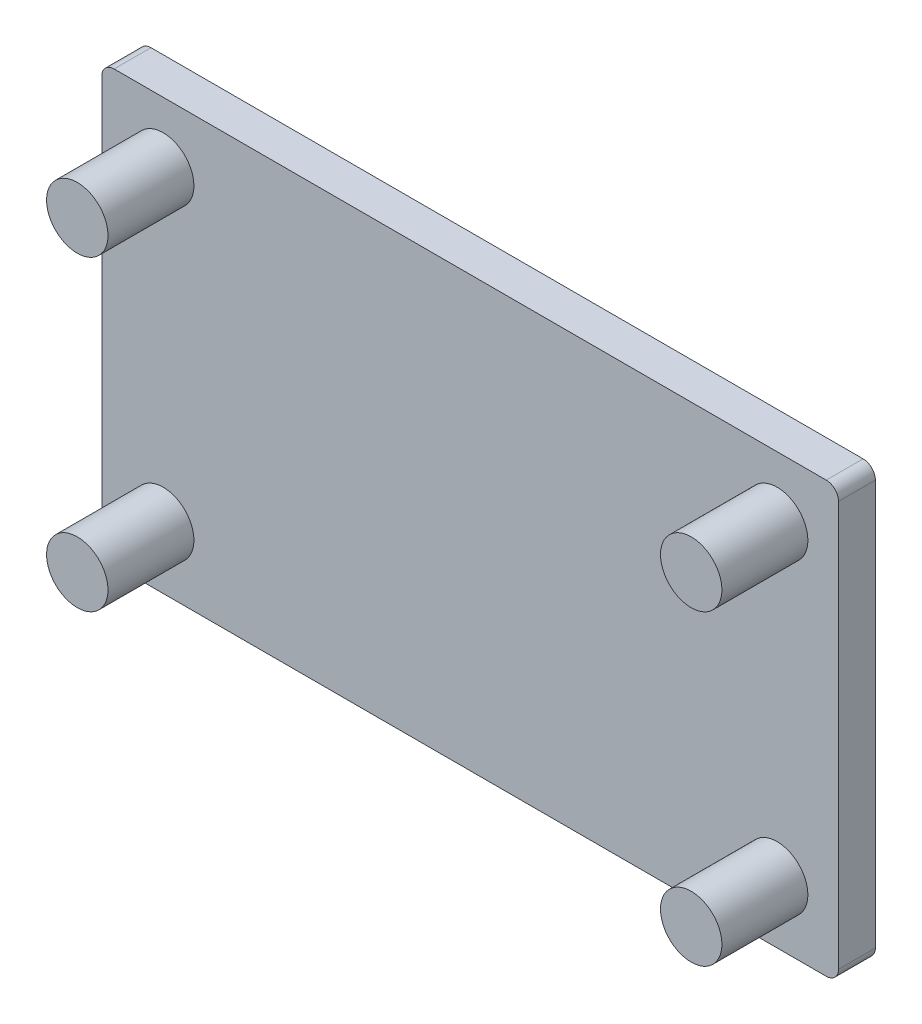
from build123d import *

# Parameters (mm, degrees)
SKETCH_1_W          = 60
SKETCH_1_H          = 35
EXTRUDE_1_DEPTH     = 3
FILLET_1_R          = 1
SKETCH_2_W          = 58
SKETCH_2_H          = 33
CUT_EXTRUDE_1_DEPTH = 1
FILLET_2_R          = 0.5
SKETCH_3_R          = 1
SKETCH_3_R_2        = 1.8
EXTRUDE_2_DEPTH     = 1
FILLET_5_R          = 0.9
SKETCH_4_R          = 2.5
EXTRUDE_3_DEPTH     = 7


with BuildPart() as part:
    # 草圖1 → 填料-伸長1 (new body)
    with BuildSketch(Plane.XY):
        with Locations((0, -2.493999949)):
            Rectangle(SKETCH_1_W, SKETCH_1_H)
    extrude(amount=EXTRUDE_1_DEPTH)

    # 圓角1
    fillet_1_edges = [part.edges().sort_by_distance(p)[0] for p in [
        (-30, 15.006000051, 1.5),
        (30, 15.006000051, 1.5),
        (30, -19.993999949, 1.5),
        (-30, -19.993999949, 1.5),
    ]]
    fillet(fillet_1_edges, radius=FILLET_1_R)

    # 草圖2 → 除料-伸長1 (cut)
    with BuildSketch(Plane.XY):
        with Locations((0, -2.493999949)):
            Rectangle(SKETCH_2_W, SKETCH_2_H)
    extrude(amount=CUT_EXTRUDE_1_DEPTH, mode=Mode.SUBTRACT)

    # 圓角2
    fillet_2_edges = [part.edges().sort_by_distance(p)[0] for p in [
        (29, -18.993999949, 0.5),
        (29, 14.006000051, 0.5),
        (-29, 14.006000051, 0.5),
        (-29, -18.993999949, 0.5),
    ]]
    fillet(fillet_2_edges, radius=FILLET_2_R)

    # 草圖3 → 填料-伸長2 (add)
    # profile 1 of 18: a face of its own
    with BuildSketch(Plane(origin=(0, 0, 1), x_dir=(-1, 0, 0), z_dir=(0, 0, -1))):
        with Locations((16.605864627, -11.590408673)):
            Circle(SKETCH_3_R)
    # profile 2 of 18: a face of its own
    with BuildSketch(Plane(origin=(0, 0, 1), x_dir=(-1, 0, 0), z_dir=(0, 0, -1))):
        with Locations((19.716080198, -10.097753374)):
            Circle(SKETCH_3_R_2)
    # profile 3 of 18: a face of its own
    with BuildSketch(Plane(origin=(0, 0, 1), x_dir=(-1, 0, 0), z_dir=(0, 0, -1))):
        Polygon((-25.746316962, -10.487625831), (-24.457925625, -14.339759351), (-20.787212343, -17.520537835), (-23.390948179, -14.339759351), align=None)
    # profile 4 of 18: a face of its own
    with BuildSketch(Plane(origin=(0, 0, 1), x_dir=(-1, 0, 0), z_dir=(0, 0, -1))):
        Polygon((-22.289971319, -9.225308291), (-20.125052457, -12.630867275), (-17.960499983, -16.334510998), (-20.125052457, -11.092385683), align=None)
    # profile 5 of 18: a face of its own
    with BuildSketch(Plane(origin=(0, 0, 1), x_dir=(-1, 0, 0), z_dir=(0, 0, -1))):
        Polygon((-25.37730312, -8.085964983), (-23.841775872, -11.58365246), (-18.713404958, -17.550593014), (-22.797768184, -10.169993512), (-22.900189922, -10.477389366), align=None)
    # profile 6 of 18: a face of its own
    with BuildSketch(Plane(origin=(0, 0, 1), x_dir=(-1, 0, 0), z_dir=(0, 0, -1))):
        with BuildLine():
            ThreePointArc((17.036310089, -16.144137721), (20.180543809, -12.568524264), (24.912645346, -13.096191133))
            ThreePointArc((24.912645346, -13.096191133), (20.547061469, -13.51565896), (17.036310089, -16.144137721))
        make_face()
    # profile 7 of 18: a face of its own
    with BuildSketch(Plane(origin=(0, 0, 1), x_dir=(-1, 0, 0), z_dir=(0, 0, -1))):
        with BuildLine():
            Line((-25.869565217, -5.597151862), (-25.869565217, 4.902848138))
            Line((-25.869565217, 4.902848138), (-22.46705163, 4.902848138))
            add(Edge.make_bspline(
                [(-22.46705163, 4.902848138), (-22.321957456, 4.901145897), (-22.040191767, 4.89784023), (-21.632274313, 4.86894773), (-21.251526575, 4.823132463), (-20.900208266, 4.75303157), (-20.574579701, 4.67016426), (-20.279109305, 4.561034768), (-20.008236351, 4.440416348), (-19.768715618, 4.292789558), (-19.555347837, 4.129931994), (-19.371740178, 3.943866358), (-19.217809716, 3.738145243), (-19.085465835, 3.515064403), (-18.989959614, 3.268630652), (-18.920977899, 3.003708763), (-18.877063093, 2.719969635), (-18.872109794, 2.52371007), (-18.869565217, 2.422888899)],
                knots=[0, 0, 0, 0, 1.402020869, 2.722654989, 3.950110139, 5.105271457, 6.182839017, 7.193223738, 8.145991228, 9.043198014, 9.905766409, 10.734443583, 11.560141935, 12.38384842, 13.232981204, 14.104313047, 15.026160196, 16, 16, 16, 16], degree=3))
            add(Edge.make_bspline(
                [(-18.869565217, 2.422888899), (-18.874374153, 2.295002495), (-18.883942705, 2.040541276), (-18.953204733, 1.667214701), (-19.071290378, 1.313146936), (-19.241334104, 0.987195047), (-19.460030163, 0.693072429), (-19.682634094, 0.480176921), (-19.884295006, 0.332506586), (-20.048932871, 0.231443768), (-20.228024768, 0.146193591), (-20.35366912, 0.09969125), (-20.417459239, 0.076081834)],
                knots=[0, 0, 0, 0, 1.273298406, 2.533538006, 3.766639183, 4.977638108, 6.179029059, 7.401702507, 8.028476186, 8.666091093, 9.322769338, 10, 10, 10, 10], degree=3))
            add(Edge.make_bspline(
                [(-20.417459239, 0.076081834), (-20.28521325, 0.049195474), (-20.018982423, -0.004930764), (-19.707828153, -0.146120928), (-19.469510556, -0.278589546), (-19.306042136, -0.400496003), (-19.149091975, -0.530224156), (-19.007899797, -0.678771574), (-18.875673165, -0.837969104), (-18.759252597, -1.011573608), (-18.658731473, -1.200092016), (-18.57115567, -1.400902414), (-18.499012357, -1.614471406), (-18.449548027, -1.841716761), (-18.417696688, -2.080387367), (-18.414610671, -2.244465536), (-18.413043478, -2.327790449)],
                knots=[0, 0, 0, 0, 1.6519262, 3.32557291, 4.166740498, 4.995835318, 5.824301884, 6.663779587, 7.507195088, 8.362647254, 9.224604015, 10.126598034, 11.049652309, 11.986803716, 12.977625078, 14, 14, 14, 14], degree=3))
            add(Edge.make_bspline(
                [(-18.413043478, -2.327790449), (-18.415764502, -2.459565142), (-18.421065642, -2.716290633), (-18.475833294, -3.08786687), (-18.556785341, -3.435515195), (-18.675920023, -3.757157242), (-18.832880496, -4.051030373), (-19.018139879, -4.323396873), (-19.242618085, -4.56678782), (-19.498250913, -4.786901701), (-19.786852405, -4.979470535), (-20.107388176, -5.142817241), (-20.45390951, -5.286926428), (-20.833044998, -5.398922171), (-21.240197802, -5.490967068), (-21.679582, -5.548741325), (-22.147562857, -5.592455681), (-22.470106776, -5.595557675), (-22.635869565, -5.597151862)],
                knots=[0, 0, 0, 0, 1.039371005, 2.024918617, 2.958047709, 3.852767572, 4.723053758, 5.582001921, 6.445494094, 7.328259018, 8.239147345, 9.176460892, 10.16391264, 11.196919877, 12.292741297, 13.455226912, 14.692182175, 16, 16, 16, 16], degree=3))
            Line((-22.635869565, -5.597151862), (-25.869565217, -5.597151862))
        make_face()
        with BuildLine():
            add(Edge.make_bspline(
                [(-21, 2.099519334), (-21.004288572, 2.192693357), (-21.012600458, 2.373278411), (-21.073429991, 2.589936017), (-21.147238708, 2.744293277), (-21.214761071, 2.851369508), (-21.297597103, 2.94875709), (-21.397599051, 3.034645381), (-21.509355672, 3.113675902), (-21.636460015, 3.182394472), (-21.778107143, 3.242313623), (-21.935173558, 3.291178559), (-22.107343826, 3.332525472), (-22.296805955, 3.359399793), (-22.503059922, 3.380039899), (-22.646905904, 3.380744028), (-22.721467391, 3.381109008)],
                knots=[0, 0, 0, 0, 1.599357931, 3.099792517, 3.824733362, 4.535069213, 5.269290696, 6.012427379, 6.794603599, 7.61746315, 8.490210935, 9.433542011, 10.441150938, 11.529478764, 12.719423833, 14, 14, 14, 14], degree=3))
            Line((-22.721467391, 3.381109008), (-23.891304348, 3.381109008))
            Line((-23.891304348, 3.381109008), (-23.891304348, 0.641978573))
            Line((-23.891304348, 0.641978573), (-22.721467391, 0.641978573))
            add(Edge.make_bspline(
                [(-22.721467391, 0.641978573), (-22.64532739, 0.643230793), (-22.499062551, 0.645636307), (-22.289119817, 0.667059758), (-22.098057426, 0.702106098), (-21.924749719, 0.751459116), (-21.769362002, 0.817857686), (-21.626986521, 0.88913314), (-21.50061449, 0.97463945), (-21.353869139, 1.099552087), (-21.19967464, 1.279818896), (-21.081954357, 1.534948251), (-21.010346078, 1.81021473), (-21.003502636, 2.001576071), (-21, 2.099519334)],
                knots=[0, 0, 0, 0, 1.069032976, 2.053610886, 2.959553848, 3.794328356, 4.577732592, 5.329421169, 6.02708937, 6.714020821, 8.033657071, 9.318040837, 10.627309837, 12, 12, 12, 12], degree=3))
        make_face(mode=Mode.SUBTRACT)
        with BuildLine():
            add(Edge.make_bspline(
                [(-22.490828804, -3.923238818), (-22.413087596, -3.922167549), (-22.261969355, -3.920085148), (-22.043409356, -3.895527139), (-21.839818915, -3.857860964), (-21.650963605, -3.805994576), (-21.476514136, -3.738359314), (-21.31596634, -3.661537871), (-21.16990495, -3.571803991), (-21.039775754, -3.470544708), (-20.925176954, -3.356580022), (-20.82132012, -3.237213801), (-20.738646183, -3.103152474), (-20.643033507, -2.917429298), (-20.559979775, -2.662432288), (-20.549025498, -2.449755897), (-20.543478261, -2.342056753)],
                knots=[0, 0, 0, 0, 1.157126176, 2.249294499, 3.270071966, 4.237898203, 5.160636285, 6.052674293, 6.8846023, 7.708539307, 8.501376315, 9.288660001, 10.058048539, 10.83920472, 12.39937595, 14, 14, 14, 14], degree=3))
            add(Edge.make_bspline(
                [(-20.543478261, -2.342056753), (-20.544402738, -2.28646276), (-20.546223095, -2.176994444), (-20.573672248, -2.018457671), (-20.614806369, -1.869018429), (-20.667526864, -1.727455742), (-20.744078064, -1.597897913), (-20.833353184, -1.476708817), (-20.940648969, -1.366111659), (-21.061379949, -1.263279261), (-21.200675552, -1.172898817), (-21.35624922, -1.094434699), (-21.529048118, -1.027611569), (-21.719423846, -0.973713713), (-21.926892177, -0.931400265), (-22.150772763, -0.900089208), (-22.392340899, -0.884845634), (-22.558973896, -0.881496981), (-22.645380435, -0.879760557)],
                knots=[0, 0, 0, 0, 0.919965197, 1.811473402, 2.655599999, 3.487070925, 4.30463685, 5.139728507, 5.975542427, 6.851443155, 7.761895275, 8.719057734, 9.733411133, 10.826385967, 11.992916024, 13.238912289, 14.568254558, 16, 16, 16, 16], degree=3))
            Line((-22.645380435, -0.879760557), (-23.891304348, -0.879760557))
            Line((-23.891304348, -0.879760557), (-23.891304348, -3.923238818))
            Line((-23.891304348, -3.923238818), (-22.490828804, -3.923238818))
        make_face(mode=Mode.SUBTRACT)
    # profile 8 of 18: a face of its own
    with BuildSketch(Plane(origin=(0, 0, 1), x_dir=(-1, 0, 0), z_dir=(0, 0, -1))):
        Polygon((-11.237092391, -5.597151862), (-11.819633152, -3.466717079), (-15.474184783, -3.466717079), (-16.075747283, -5.597151862), (-18.032608696, -5.597151862), (-14.917798913, 4.902848138), (-12.157269022, 4.902848138), (-9.054347826, -5.597151862), align=None)
        Polygon((-13.619565217, 3.102916073), (-14.998641304, -1.792804036), (-12.276154891, -1.792804036), align=None, mode=Mode.SUBTRACT)
    # profile 9 of 18: a face of its own
    with BuildSketch(Plane(origin=(0, 0, 1), x_dir=(-1, 0, 0), z_dir=(0, 0, -1))):
        with BuildLine():
            add(Edge.make_bspline(
                [(-0.304347826, -0.213999688), (-0.307732262, -0.413094914), (-0.314353892, -0.802623602), (-0.374022001, -1.372842717), (-0.463491751, -1.915811112), (-0.597733204, -2.428640659), (-0.76691184, -2.909894281), (-0.97887734, -3.357071003), (-1.237965376, -3.764935293), (-1.535325881, -4.138953406), (-1.878544998, -4.472561664), (-2.267807111, -4.763905609), (-2.700871942, -5.016811555), (-3.178937993, -5.228955736), (-3.704177913, -5.395999311), (-4.278009705, -5.51275787), (-4.901016982, -5.584811856), (-5.333013679, -5.592941751), (-5.556725543, -5.597151862)],
                knots=[0, 0, 0, 0, 1.110427075, 2.172544315, 3.195349749, 4.177748535, 5.125988168, 6.037741059, 6.932042727, 7.815964876, 8.69777207, 9.594508137, 10.521994162, 11.48995721, 12.506588634, 13.59059811, 14.752277985, 16, 16, 16, 16], degree=3))
            Line((-5.556725543, -5.597151862), (-8.217391304, -5.597151862))
            Line((-8.217391304, -5.597151862), (-8.217391304, 4.902848138))
            Line((-8.217391304, 4.902848138), (-5.114470109, 4.902848138))
            add(Edge.make_bspline(
                [(-5.114470109, 4.902848138), (-4.920121843, 4.899541907), (-4.543219828, 4.893130093), (-3.996619515, 4.833882888), (-3.486538146, 4.744830225), (-3.014505473, 4.610487057), (-2.579831728, 4.439686841), (-2.179711261, 4.230905914), (-1.821993359, 3.973897757), (-1.500262762, 3.678627067), (-1.213367231, 3.343771674), (-0.972297508, 2.961252064), (-0.763424195, 2.540295742), (-0.596462908, 2.075381192), (-0.46160879, 1.568276349), (-0.372887087, 1.014617513), (-0.313909696, 0.415787196), (-0.307611242, 0.000943286), (-0.304347826, -0.213999688)],
                knots=[0, 0, 0, 0, 1.153278946, 2.236568238, 3.259968389, 4.223524422, 5.144358991, 6.028301925, 6.89516473, 7.750925641, 8.615384892, 9.504135122, 10.427813762, 11.399741143, 12.431359603, 13.538177242, 14.724456375, 16, 16, 16, 16], degree=3))
        make_face()
        with BuildLine():
            add(Edge.make_bspline(
                [(-2.434782609, -0.342396427), (-2.436983589, -0.205256478), (-2.441274364, 0.062095628), (-2.463668106, 0.451909712), (-2.506764534, 0.818544431), (-2.565484353, 1.161785409), (-2.641740947, 1.482805918), (-2.746539079, 1.777170063), (-2.87318767, 2.046896325), (-3.022950562, 2.291592275), (-3.199668846, 2.509884676), (-3.404733256, 2.700167965), (-3.63681136, 2.862349599), (-3.897226964, 2.997109112), (-4.188315598, 3.101544383), (-4.510517276, 3.176672568), (-4.865884234, 3.222285847), (-5.113533225, 3.226653899), (-5.242866848, 3.228935095)],
                knots=[0, 0, 0, 0, 1.255554051, 2.44768226, 3.572651082, 4.633086061, 5.634384971, 6.589040905, 7.488061995, 8.357917203, 9.208928104, 10.050890238, 10.910395455, 11.793077134, 12.727247796, 13.733895114, 14.81653645, 16, 16, 16, 16], degree=3))
            Line((-5.242866848, 3.228935095), (-6.239130435, 3.228935095))
            Line((-6.239130435, 3.228935095), (-6.239130435, -3.923238818))
            Line((-6.239130435, -3.923238818), (-5.378396739, -3.923238818))
            add(Edge.make_bspline(
                [(-5.378396739, -3.923238818), (-5.261758733, -3.920507273), (-5.034887907, -3.915194187), (-4.70551876, -3.873862669), (-4.39670831, -3.808845607), (-4.110026987, -3.712885726), (-3.844541306, -3.592219016), (-3.601180558, -3.442645653), (-3.379416313, -3.266770884), (-3.18031351, -3.061852748), (-3.001599936, -2.829303931), (-2.851537174, -2.562938799), (-2.718669429, -2.26941382), (-2.616190534, -1.942332049), (-2.532264002, -1.586558247), (-2.477726002, -1.19812302), (-2.440839619, -0.780611779), (-2.436843354, -0.491488216), (-2.434782609, -0.342396427)],
                knots=[0, 0, 0, 0, 1.054031268, 2.050180318, 2.995897094, 3.902119281, 4.777280808, 5.626335315, 6.477804485, 7.328942045, 8.203017891, 9.120973329, 10.086270126, 11.110341295, 12.2138552, 13.387141734, 14.65263243, 16, 16, 16, 16], degree=3))
        make_face(mode=Mode.SUBTRACT)
    # profile 10 of 18: a face of its own
    with BuildSketch(Plane(origin=(0, 0, 1), x_dir=(-1, 0, 0), z_dir=(0, 0, -1))):
        with BuildLine():
            Line((1.065217391, -5.597151862), (1.065217391, 4.902848138))
            Line((1.065217391, 4.902848138), (4.467730978, 4.902848138))
            add(Edge.make_bspline(
                [(4.467730978, 4.902848138), (4.612825152, 4.901145897), (4.894590842, 4.89784023), (5.302508296, 4.86894773), (5.683256034, 4.823132463), (6.034574342, 4.75303157), (6.360202907, 4.67016426), (6.655673304, 4.561034768), (6.926546258, 4.440416348), (7.166066991, 4.292789558), (7.379434771, 4.129931994), (7.563042431, 3.943866358), (7.716972893, 3.738145243), (7.849316774, 3.515064403), (7.944822995, 3.268630652), (8.01380471, 3.003708763), (8.057719515, 2.719969635), (8.062672815, 2.52371007), (8.065217391, 2.422888899)],
                knots=[0, 0, 0, 0, 1.402020869, 2.722654989, 3.950110139, 5.105271457, 6.182839017, 7.193223738, 8.145991228, 9.043198014, 9.905766409, 10.734443583, 11.560141935, 12.38384842, 13.232981204, 14.104313047, 15.026160196, 16, 16, 16, 16], degree=3))
            add(Edge.make_bspline(
                [(8.065217391, 2.422888899), (8.060408455, 2.295002495), (8.050839903, 2.040541276), (7.981577875, 1.667214701), (7.863492231, 1.313146936), (7.693448505, 0.987195047), (7.474752446, 0.693072429), (7.252148514, 0.480176921), (7.050487603, 0.332506586), (6.885849738, 0.231443768), (6.706757841, 0.146193591), (6.581113488, 0.09969125), (6.51732337, 0.076081834)],
                knots=[0, 0, 0, 0, 1.273298406, 2.533538006, 3.766639183, 4.977638108, 6.179029059, 7.401702507, 8.028476186, 8.666091093, 9.322769338, 10, 10, 10, 10], degree=3))
            add(Edge.make_bspline(
                [(6.51732337, 0.076081834), (6.649569359, 0.049195474), (6.915800186, -0.004930764), (7.226954455, -0.146120928), (7.465272053, -0.278589546), (7.628740473, -0.400496003), (7.785690633, -0.530224156), (7.926882811, -0.678771574), (8.059109443, -0.837969104), (8.175530012, -1.011573608), (8.276051136, -1.200092016), (8.363626939, -1.400902414), (8.435770252, -1.614471406), (8.485234582, -1.841716761), (8.517085921, -2.080387367), (8.520171938, -2.244465536), (8.52173913, -2.327790449)],
                knots=[0, 0, 0, 0, 1.6519262, 3.32557291, 4.166740498, 4.995835318, 5.824301884, 6.663779587, 7.507195088, 8.362647254, 9.224604015, 10.126598034, 11.049652309, 11.986803716, 12.977625078, 14, 14, 14, 14], degree=3))
            add(Edge.make_bspline(
                [(8.52173913, -2.327790449), (8.519018107, -2.459565142), (8.513716967, -2.716290633), (8.458949314, -3.08786687), (8.377997267, -3.435515195), (8.258862586, -3.757157242), (8.101902113, -4.051030373), (7.91664273, -4.323396873), (7.692164524, -4.56678782), (7.436531696, -4.786901701), (7.147930204, -4.979470535), (6.827394432, -5.142817241), (6.480873099, -5.286926428), (6.10173761, -5.398922171), (5.694584807, -5.490967068), (5.255200609, -5.548741325), (4.787219752, -5.592455681), (4.464675833, -5.595557675), (4.298913043, -5.597151862)],
                knots=[0, 0, 0, 0, 1.039371005, 2.024918617, 2.958047709, 3.852767572, 4.723053758, 5.582001921, 6.445494094, 7.328259018, 8.239147345, 9.176460892, 10.16391264, 11.196919877, 12.292741297, 13.455226912, 14.692182175, 16, 16, 16, 16], degree=3))
            Line((4.298913043, -5.597151862), (1.065217391, -5.597151862))
        make_face()
        with BuildLine():
            add(Edge.make_bspline(
                [(5.934782609, 2.099519334), (5.930494037, 2.192693357), (5.922182151, 2.373278411), (5.861352618, 2.589936017), (5.787543901, 2.744293277), (5.720021538, 2.851369508), (5.637185506, 2.94875709), (5.537183557, 3.034645381), (5.425426936, 3.113675902), (5.298322593, 3.182394472), (5.156675466, 3.242313623), (4.99960905, 3.291178559), (4.827438783, 3.332525472), (4.637976654, 3.359399793), (4.431722687, 3.380039899), (4.287876704, 3.380744028), (4.213315217, 3.381109008)],
                knots=[0, 0, 0, 0, 1.599357931, 3.099792517, 3.824733362, 4.535069213, 5.269290696, 6.012427379, 6.794603599, 7.61746315, 8.490210935, 9.433542011, 10.441150938, 11.529478764, 12.719423833, 14, 14, 14, 14], degree=3))
            Line((4.213315217, 3.381109008), (3.043478261, 3.381109008))
            Line((3.043478261, 3.381109008), (3.043478261, 0.641978573))
            Line((3.043478261, 0.641978573), (4.213315217, 0.641978573))
            add(Edge.make_bspline(
                [(4.213315217, 0.641978573), (4.289455219, 0.643230793), (4.435720057, 0.645636307), (4.645662792, 0.667059758), (4.836725183, 0.702106098), (5.010032889, 0.751459116), (5.165420607, 0.817857686), (5.307796087, 0.88913314), (5.434168118, 0.97463945), (5.58091347, 1.099552087), (5.735107969, 1.279818896), (5.852828252, 1.534948251), (5.92443653, 1.81021473), (5.931279973, 2.001576071), (5.934782609, 2.099519334)],
                knots=[0, 0, 0, 0, 1.069032976, 2.053610886, 2.959553848, 3.794328356, 4.577732592, 5.329421169, 6.02708937, 6.714020821, 8.033657071, 9.318040837, 10.627309837, 12, 12, 12, 12], degree=3))
        make_face(mode=Mode.SUBTRACT)
        with BuildLine():
            add(Edge.make_bspline(
                [(4.443953804, -3.923238818), (4.521695013, -3.922167549), (4.672813254, -3.920085148), (4.891373252, -3.895527139), (5.094963693, -3.857860964), (5.283819004, -3.805994576), (5.458268473, -3.738359314), (5.618816268, -3.661537871), (5.764877659, -3.571803991), (5.895006854, -3.470544708), (6.009605655, -3.356580022), (6.113462489, -3.237213801), (6.196136426, -3.103152474), (6.291749102, -2.917429298), (6.374802834, -2.662432288), (6.385757111, -2.449755897), (6.391304348, -2.342056753)],
                knots=[0, 0, 0, 0, 1.157126176, 2.249294499, 3.270071966, 4.237898203, 5.160636285, 6.052674293, 6.8846023, 7.708539307, 8.501376315, 9.288660001, 10.058048539, 10.83920472, 12.39937595, 14, 14, 14, 14], degree=3))
            add(Edge.make_bspline(
                [(6.391304348, -2.342056753), (6.390379871, -2.28646276), (6.388559514, -2.176994444), (6.36111036, -2.018457671), (6.31997624, -1.869018429), (6.267255745, -1.727455742), (6.190704545, -1.597897913), (6.101429424, -1.476708817), (5.99413364, -1.366111659), (5.87340266, -1.263279261), (5.734107057, -1.172898817), (5.578533389, -1.094434699), (5.405734491, -1.027611569), (5.215358762, -0.973713713), (5.007890432, -0.931400265), (4.784009846, -0.900089208), (4.542441709, -0.884845634), (4.375808713, -0.881496981), (4.289402174, -0.879760557)],
                knots=[0, 0, 0, 0, 0.919965197, 1.811473402, 2.655599999, 3.487070925, 4.30463685, 5.139728507, 5.975542427, 6.851443155, 7.761895275, 8.719057734, 9.733411133, 10.826385967, 11.992916024, 13.238912289, 14.568254558, 16, 16, 16, 16], degree=3))
            Line((4.289402174, -0.879760557), (3.043478261, -0.879760557))
            Line((3.043478261, -0.879760557), (3.043478261, -3.923238818))
            Line((3.043478261, -3.923238818), (4.443953804, -3.923238818))
        make_face(mode=Mode.SUBTRACT)
    # profile 11 of 18: a face of its own
    with BuildSketch(Plane(origin=(0, 0, 1), x_dir=(-1, 0, 0), z_dir=(0, 0, -1))):
        with BuildLine():
            add(Edge.make_bspline(
                [(17.804347826, -0.299597514), (17.800255963, -0.528783524), (17.792353603, -0.971396247), (17.731495124, -1.611642454), (17.625305448, -2.202560978), (17.477954054, -2.744970782), (17.294843387, -3.238842359), (17.080405144, -3.687823483), (16.833717545, -4.091210586), (16.554146923, -4.44857572), (16.244489082, -4.758438845), (15.913792892, -5.030751022), (15.552941486, -5.255024913), (15.170075279, -5.438066319), (14.7678988, -5.578548982), (14.349778202, -5.674219555), (13.919658172, -5.740090844), (13.626948883, -5.74622909), (13.479279891, -5.749325775)],
                knots=[0, 0, 0, 0, 1.399094986, 2.701985343, 3.921606295, 5.060250114, 6.128937938, 7.133140352, 8.093336986, 9.010033534, 9.896223585, 10.76303321, 11.619598843, 12.483160966, 13.349322064, 14.214333538, 15.099148625, 16, 16, 16, 16], degree=3))
            add(Edge.make_bspline(
                [(13.479279891, -5.749325775), (13.31024205, -5.745499111), (12.981971932, -5.73806776), (12.505606136, -5.672500331), (12.061228859, -5.566832156), (11.648955094, -5.416893841), (11.269695932, -5.222624502), (10.922192596, -4.986258283), (10.608305332, -4.704723263), (10.326778675, -4.381946993), (10.078486529, -4.017672689), (9.864942877, -3.613577632), (9.683511153, -3.170785327), (9.538640233, -2.689264517), (9.420229117, -2.170871443), (9.343043071, -1.613156082), (9.291076623, -1.017068202), (9.285489625, -0.606444059), (9.282608696, -0.394706209)],
                knots=[0, 0, 0, 0, 1.046182631, 2.031678192, 2.97076483, 3.86965419, 4.740954983, 5.602542005, 6.464464361, 7.344346083, 8.248138063, 9.187737429, 10.169205071, 11.206116273, 12.297806163, 13.458167033, 14.68930686, 16, 16, 16, 16], degree=3))
            add(Edge.make_bspline(
                [(9.282608696, -0.394706209), (9.286639524, -0.165510766), (9.294424014, 0.277120176), (9.356014211, 0.916322492), (9.459125961, 1.506782845), (9.605932632, 2.048887457), (9.793305311, 2.542134977), (10.005709485, 2.993116422), (10.253353986, 3.396858835), (10.532786869, 3.754271154), (10.842450525, 4.064181714), (11.173250681, 4.336266854), (11.53339686, 4.561210936), (11.917496575, 4.740961843), (12.320023627, 4.88174374), (12.73773771, 4.980057103), (13.168095186, 5.045804024), (13.460011587, 5.051925514), (13.60767663, 5.055022051)],
                knots=[0, 0, 0, 0, 1.399147349, 2.702086469, 3.916134137, 5.054820572, 6.125245074, 7.133847534, 8.094080105, 9.010810961, 9.897034179, 10.763876246, 11.620473937, 12.481991629, 13.348185144, 14.219056267, 15.099114909, 16, 16, 16, 16], degree=3))
            add(Edge.make_bspline(
                [(13.60767663, 5.055022051), (13.776713626, 5.051194148), (14.104982101, 5.043760391), (14.581359487, 4.978209945), (15.025695843, 4.872481801), (15.4381133, 4.722754069), (15.816461741, 4.527935958), (16.165517666, 4.294647172), (16.478514656, 4.012618145), (16.760296854, 3.690113034), (17.007725954, 3.326135152), (17.222743949, 2.923616788), (17.402797559, 2.481804481), (17.549158714, 2.000749577), (17.666566094, 1.481256863), (17.743950819, 0.921235474), (17.795795262, 0.323546874), (17.801441791, -0.087862242), (17.804347826, -0.299597514)],
                knots=[0, 0, 0, 0, 1.04600235, 2.031328089, 2.970252902, 3.868987364, 4.740138012, 5.59881955, 6.460593378, 7.340323477, 8.243959714, 9.179069388, 10.160367901, 11.192410958, 12.288699193, 13.453715767, 14.689532722, 16, 16, 16, 16], degree=3))
        make_face()
        with BuildLine():
            add(Edge.make_bspline(
                [(15.673913043, -0.394706209), (15.67288444, -0.247247521), (15.670892133, 0.038366048), (15.645955555, 0.452362452), (15.609682245, 0.837419604), (15.555380474, 1.193204568), (15.484235851, 1.519523696), (15.398973148, 1.81753202), (15.300963803, 2.087662219), (15.182828721, 2.327699863), (15.051542526, 2.54225912), (14.894100731, 2.725709315), (14.71691828, 2.880129302), (14.523035026, 3.011995431), (14.305411598, 3.109537573), (14.068240597, 3.177138091), (13.81222058, 3.221593063), (13.634818032, 3.226439695), (13.543478261, 3.228935095)],
                knots=[0, 0, 0, 0, 1.486095503, 2.8784268, 4.178896477, 5.383313849, 6.50370181, 7.542880676, 8.505944191, 9.395566462, 10.23559869, 11.034510805, 11.821349203, 12.599050339, 13.389126436, 14.213243526, 15.080047443, 16, 16, 16, 16], degree=3))
            add(Edge.make_bspline(
                [(13.543478261, 3.228935095), (13.452161839, 3.226365939), (13.275586528, 3.221398052), (13.020300913, 3.178292919), (12.785757478, 3.104748666), (12.572191757, 3.001671637), (12.378456455, 2.871031907), (12.204401926, 2.712264525), (12.045914259, 2.527247386), (11.905971492, 2.314570329), (11.784323943, 2.075183894), (11.683777549, 1.808836926), (11.594604007, 1.518669042), (11.527706044, 1.201721251), (11.475085546, 0.861179971), (11.44173105, 0.495840825), (11.415933931, 0.106564259), (11.414025243, -0.161641467), (11.413043478, -0.299597514)],
                knots=[0, 0, 0, 0, 0.940493395, 1.818598556, 2.65806311, 3.465325826, 4.253609174, 5.057352584, 5.885618443, 6.757702066, 7.674492596, 8.646685703, 9.687886232, 10.799631583, 11.981266591, 13.236822997, 14.578714251, 16, 16, 16, 16], degree=3))
            add(Edge.make_bspline(
                [(11.413043478, -0.299597514), (11.414151536, -0.447048837), (11.41629774, -0.732648141), (11.440164098, -1.14682439), (11.480131908, -1.531619811), (11.534841938, -1.887942275), (11.602106062, -2.215639907), (11.686676057, -2.514287973), (11.790468732, -2.782285728), (11.904316351, -3.024545803), (12.042042164, -3.236395045), (12.19665182, -3.421344771), (12.372212628, -3.578596146), (12.569189833, -3.705132992), (12.785450133, -3.803672137), (13.02108733, -3.871439419), (13.275496053, -3.916043163), (13.452130999, -3.920786031), (13.543478261, -3.923238818)],
                knots=[0, 0, 0, 0, 1.486662466, 2.879524953, 4.181300558, 5.38617743, 6.513130284, 7.552705609, 8.511484829, 9.408629925, 10.246547046, 11.051854149, 11.833006184, 12.613299248, 13.403676768, 14.220441868, 15.079696471, 16, 16, 16, 16], degree=3))
            add(Edge.make_bspline(
                [(13.543478261, -3.923238818), (13.634774045, -3.920587901), (13.812091159, -3.915439219), (14.068420155, -3.873163002), (14.302831285, -3.798322003), (14.519004295, -3.698695935), (14.712165307, -3.564774733), (14.889786612, -3.408266639), (15.045507904, -3.221135408), (15.183834451, -3.008967794), (15.301258176, -2.768222544), (15.407328932, -2.505337144), (15.488413346, -2.213607181), (15.557856593, -1.897835238), (15.608320587, -1.556032148), (15.64623507, -1.190338867), (15.670743928, -0.800836521), (15.672836628, -0.53265157), (15.673913043, -0.394706209)],
                knots=[0, 0, 0, 0, 0.940029382, 1.82575022, 2.664800606, 3.468147471, 4.267377886, 5.076798435, 5.899366548, 6.766536204, 7.679194691, 8.653886611, 9.682108903, 10.79330575, 11.982426563, 13.238186273, 14.579415474, 16, 16, 16, 16], degree=3))
        make_face(mode=Mode.SUBTRACT)
    # profile 12 of 18: a face of its own
    with BuildSketch(Plane(origin=(0, 0, 1), x_dir=(-1, 0, 0), z_dir=(0, 0, -1))):
        Polygon((23.434782609, -1.878401862), (23.434782609, -5.597151862), (21.456521739, -5.597151862), (21.456521739, -1.892668166), (18.108695652, 4.902848138), (20.239130435, 4.902848138), (21.768002717, 1.657263899), (22.469429348, 0.066570964), (23.180366848, 1.704818247), (24.804347826, 4.902848138), (26.934782609, 4.902848138), align=None)
    # profile 13 of 18: a face of its own
    with BuildSketch(Plane(origin=(0, 0, 1), x_dir=(-1, 0, 0), z_dir=(0, 0, -1))):
        Polygon((-8.173913043, 12.368318892), (-8.173913043, 9.006000051), (-8.927536232, 9.006000051), (-8.927536232, 12.368318892), (-10.028985507, 12.368318892), (-10.028985507, 13.006000051), (-7.072463768, 13.006000051), (-7.072463768, 12.368318892), align=None)
    # profile 14 of 18: a face of its own
    with BuildSketch(Plane(origin=(0, 0, 1), x_dir=(-1, 0, 0), z_dir=(0, 0, -1))):
        Polygon((-4.280797101, 9.006000051), (-4.502717391, 9.817594254), (-5.894927536, 9.817594254), (-6.124094203, 9.006000051), (-6.869565217, 9.006000051), (-5.682971014, 13.006000051), (-4.63134058, 13.006000051), (-3.449275362, 9.006000051), align=None)
        Polygon((-5.188405797, 12.320311645), (-5.713768116, 10.455275413), (-4.676630435, 10.455275413), align=None, mode=Mode.SUBTRACT)
    # profile 15 of 18: a face of its own
    with BuildSketch(Plane(origin=(0, 0, 1), x_dir=(-1, 0, 0), z_dir=(0, 0, -1))):
        Polygon((-2.956521739, 12.368318892), (-2.956521739, 13.006000051), (-0.463768116, 13.006000051), (-0.463768116, 12.368318892), (-1.333333333, 12.368318892), (-1.333333333, 9.64368121), (-0.463768116, 9.64368121), (-0.463768116, 9.006000051), (-2.956521739, 9.006000051), (-2.956521739, 9.64368121), (-2.086956522, 9.64368121), (-2.086956522, 12.368318892), align=None)
    # profile 16 of 18: a face of its own
    with BuildSketch(Plane(origin=(0, 0, 1), x_dir=(-1, 0, 0), z_dir=(0, 0, -1))):
        Polygon((3.130434783, 9.006000051), (2.246376812, 9.006000051), (1.85326087, 10.280456573), (1.710144928, 10.799478312), (1.559782609, 10.267775413), (1.136775362, 9.006000051), (0.289855072, 9.006000051), (0.086956522, 13.006000051), (0.750905797, 13.006000051), (0.828804348, 10.441688457), (0.848731884, 9.7406015), (1.043478261, 10.34386237), (1.518115942, 11.788608747), (1.991847826, 11.788608747), (2.454710145, 10.236072515), (2.604166667, 9.74694208), (2.614130435, 10.371036283), (2.694746377, 13.006000051), (3.333333333, 13.006000051), align=None)
    # profile 17 of 18: a face of its own
    with BuildSketch(Plane(origin=(0, 0, 1), x_dir=(-1, 0, 0), z_dir=(0, 0, -1))):
        Polygon((5.980072464, 9.006000051), (5.758152174, 9.817594254), (4.365942029, 9.817594254), (4.136775362, 9.006000051), (3.391304348, 9.006000051), (4.577898551, 13.006000051), (5.629528986, 13.006000051), (6.811594203, 9.006000051), align=None)
        Polygon((5.072463768, 12.320311645), (4.547101449, 10.455275413), (5.58423913, 10.455275413), align=None, mode=Mode.SUBTRACT)
    # profile 18 of 18: a face of its own
    with BuildSketch(Plane(origin=(0, 0, 1), x_dir=(-1, 0, 0), z_dir=(0, 0, -1))):
        Polygon((9.101449275, 9.006000051), (8.043478261, 11.392775413), (7.826086957, 11.907268167), (7.826086957, 10.248753674), (7.826086957, 9.006000051), (7.130434783, 9.006000051), (7.130434783, 13.006000051), (8.065217391, 13.006000051), (9.143115942, 10.603826138), (9.333333333, 10.135529036), (9.333333333, 11.900927587), (9.333333333, 13.006000051), (10.028985507, 13.006000051), (10.028985507, 9.006000051), align=None)
    extrude(amount=EXTRUDE_2_DEPTH)

    # 圓角5
    fillet_5_edges = [part.edges().sort_by_distance(p)[0] for p in [
        (-15.605864627, -11.590408673, 0),
        (-17.916080198, -10.097753374, 0),
    ]]
    fillet(fillet_5_edges, radius=FILLET_5_R)

    # 草圖4 → 填料-伸長3 (add)
    with BuildSketch(Plane.XY.offset(3)):
        with Locations((-25, 10.006000051)):
            Circle(SKETCH_4_R)
        with Locations((-25, -14.993999949)):
            Circle(SKETCH_4_R)
        with Locations(Location((25, -14.993999949, 0), (0, 0, 180))):
            Circle(SKETCH_4_R)
        with Locations(Location((25, 10.006000051, 0), (0, 0, 180))):
            Circle(SKETCH_4_R)
    extrude(amount=EXTRUDE_3_DEPTH)


solid = part.part
